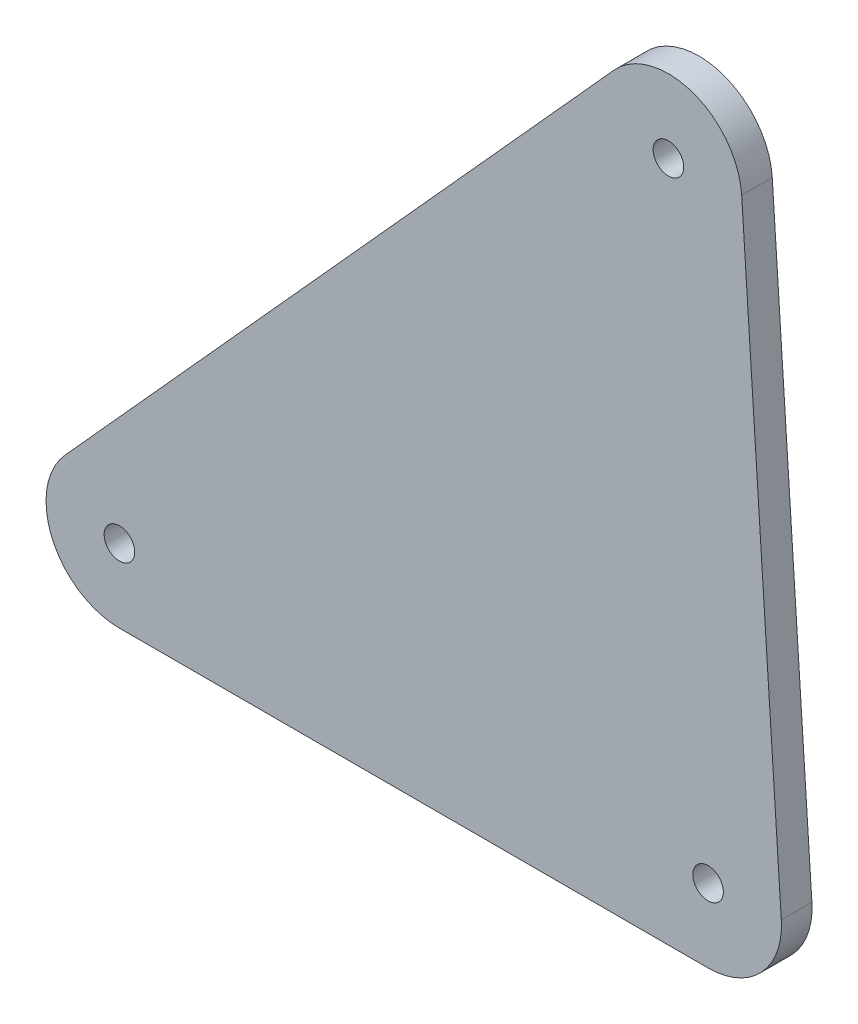
from build123d import *

# Parameters (mm, degrees)
SKETCH_1_R      = 2.5
EXTRUDE_1_DEPTH = 5


with BuildPart() as part:
    # 草图1 → 凸台-拉伸1 (new body)
    with BuildSketch(Plane.XY.offset(-18.206005243)):
        with BuildLine():
            Line((108.214557081, -42.91340116), (101.732163058, 56.475423815))
            ThreePointArc((101.732163058, 56.475423815), (93.699392778, 67.028534207), (80.851797136, 63.737208711))
            Line((80.851797136, 63.737208711), (-8.905808702, -35.651616247))
            ThreePointArc((-8.905808702, -35.651616247), (-10.966165116, -48.567114254), (0, -55.694412478))
            Line((0, -55.694412478), (96.239999844, -55.694412478))
            ThreePointArc((96.239999844, -55.694412478), (104.997058016, -51.898919293), (108.214557081, -42.91340116))
        make_face()
        with Locations(Location((89.757605827, 55.694412486, 0), (0, 0, 180))):
            Circle(SKETCH_1_R, mode=Mode.SUBTRACT)
        with Locations(Location((96.239999844, -43.694412489, 0), (0, 0, 180))):
            Circle(SKETCH_1_R, mode=Mode.SUBTRACT)
        with Locations(Location((0, -43.694412482, 0), (0, 0, 180))):
            Circle(SKETCH_1_R, mode=Mode.SUBTRACT)
    extrude(amount=-EXTRUDE_1_DEPTH)


solid = part.part
